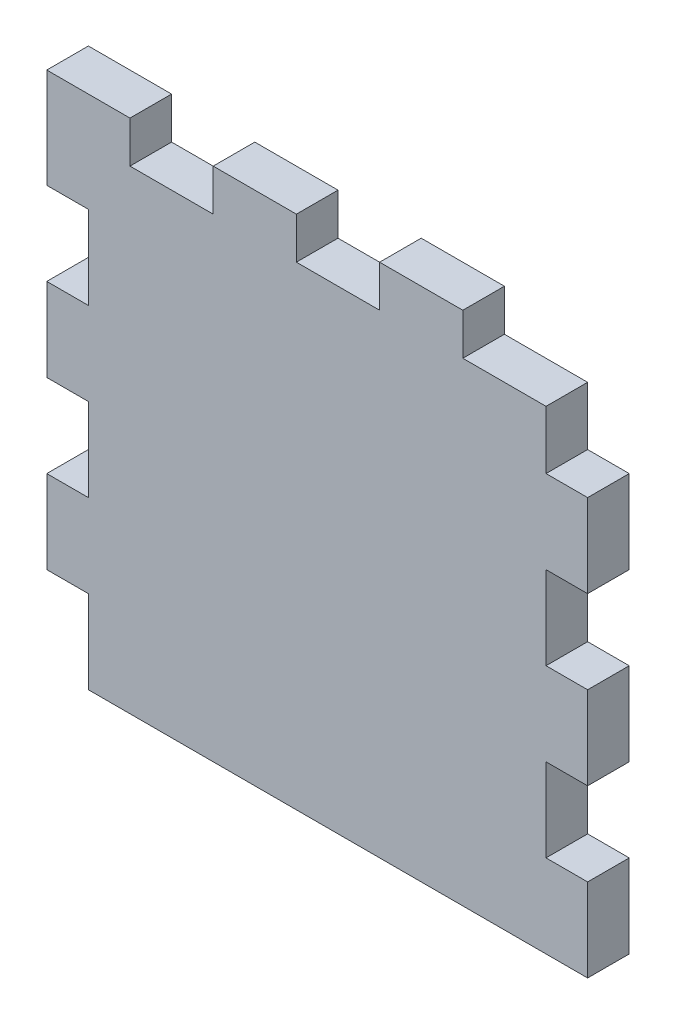
from build123d import *

# Parameters (mm, degrees)
SKETCH_1_W             = 60
SKETCH_1_H             = 57
EXTRUDE_1_DEPTH        = 5
SKETCH_2_W             = 5
SKETCH_2_H             = 10
EXTRUDE_3_DEPTH        = 5
PATTERN_LINEAR_2_COUNT = 3
PATTERN_LINEAR_2_PITCH = 20
SKETCH_3_W             = 10
SKETCH_3_H             = 5
EXTRUDE_4_DEPTH        = 5
PATTERN_LINEAR_3_COUNT = 3
PATTERN_LINEAR_3_PITCH = 20
CUT_EXTRUDE_1_REACH    = 50.706
SKETCH_4_W             = 5
SKETCH_4_H             = 10
PATTERN_LINEAR_4_COUNT = 3
PATTERN_LINEAR_4_PITCH = 20


with BuildPart() as part:
    # 스케치1 → 보스-돌출1 (new body)
    with BuildSketch(Plane.XY):
        Rectangle(SKETCH_1_W, SKETCH_1_H)
    extrude(amount=EXTRUDE_1_DEPTH)

    # 스케치2 → 보스-돌출3 (add)
    with BuildSketch(Plane.XY.offset(5)):
        with Locations((32.5, -23.5)):
            Rectangle(SKETCH_2_W, SKETCH_2_H)
    extrude_3 = extrude(amount=-EXTRUDE_3_DEPTH)

    # 선형 패턴2: 보스-돌출3 ×3
    with Locations(*[(0, i * PATTERN_LINEAR_2_PITCH, 0) for i in range(1, PATTERN_LINEAR_2_COUNT)]):
        add(extrude_3)

    # 스케치3 → 보스-돌출4 (add)
    with BuildSketch(Plane(origin=(0, 0, 0), x_dir=(-1, 0, 0), z_dir=(0, 0, -1))):
        with Locations((25, 31)):
            Rectangle(SKETCH_3_W, SKETCH_3_H)
    extrude_4 = extrude(amount=-EXTRUDE_4_DEPTH)

    # 선형 패턴3: 보스-돌출4 ×3
    with Locations(*[(i * PATTERN_LINEAR_3_PITCH, 0, 0) for i in range(1, PATTERN_LINEAR_3_COUNT)]):
        add(extrude_4)

    # 스케치4 → 컷-돌출1 (cut, up to next)
    with BuildSketch(Plane(origin=(0, 0, 0), x_dir=(-1, 0, 0), z_dir=(0, 0, -1)), mode=Mode.PRIVATE) as cut_extrude_1_sk1:
        with Locations((27.5, -23.5)):
            Rectangle(SKETCH_4_W, SKETCH_4_H)
    cut_extrude_1_tool1 = extrude(cut_extrude_1_sk1.sketch, amount=-CUT_EXTRUDE_1_REACH, mode=Mode.PRIVATE) & part.part
    cut_extrude_1 = cut_extrude_1_tool1.solids().sort_by_distance((-27.5, -23.5, 0))[0]
    add(cut_extrude_1, mode=Mode.SUBTRACT)

    # 선형 패턴4: 컷-돌출1 ×3
    with Locations(*[(0, i * PATTERN_LINEAR_4_PITCH, 0) for i in range(1, PATTERN_LINEAR_4_COUNT)]):
        add(cut_extrude_1, mode=Mode.SUBTRACT)


solid = part.part
